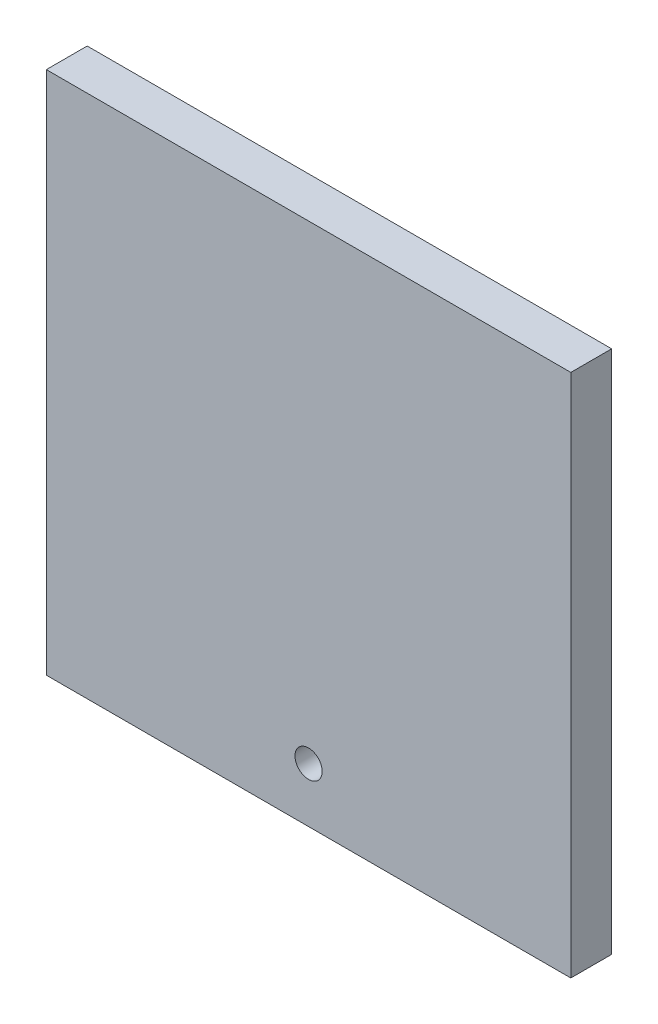
from build123d import *

# Parameters (mm, degrees)
SKETCH1_W           = 77
SKETCH1_H           = 77
BOSS_EXTRUDE1_DEPTH = 6
SKETCH2_R           = 2
CUT_EXTRUDE1_DEPTH  = 55.776819915


with BuildPart() as part:
    # Sketch1 → Boss-Extrude1 (new body)
    with BuildSketch(Plane.XY):
        Rectangle(SKETCH1_W, SKETCH1_H)
    extrude(amount=BOSS_EXTRUDE1_DEPTH)

    # Sketch2 → Cut-Extrude1 (cut, through all)
    with BuildSketch(Plane(origin=(0, 0, 0), x_dir=(-1, 0, 0), z_dir=(0, 0, -1))):
        with Locations((0, -30.5)):
            Circle(SKETCH2_R)
    extrude(amount=-CUT_EXTRUDE1_DEPTH, mode=Mode.SUBTRACT)


solid = part.part
